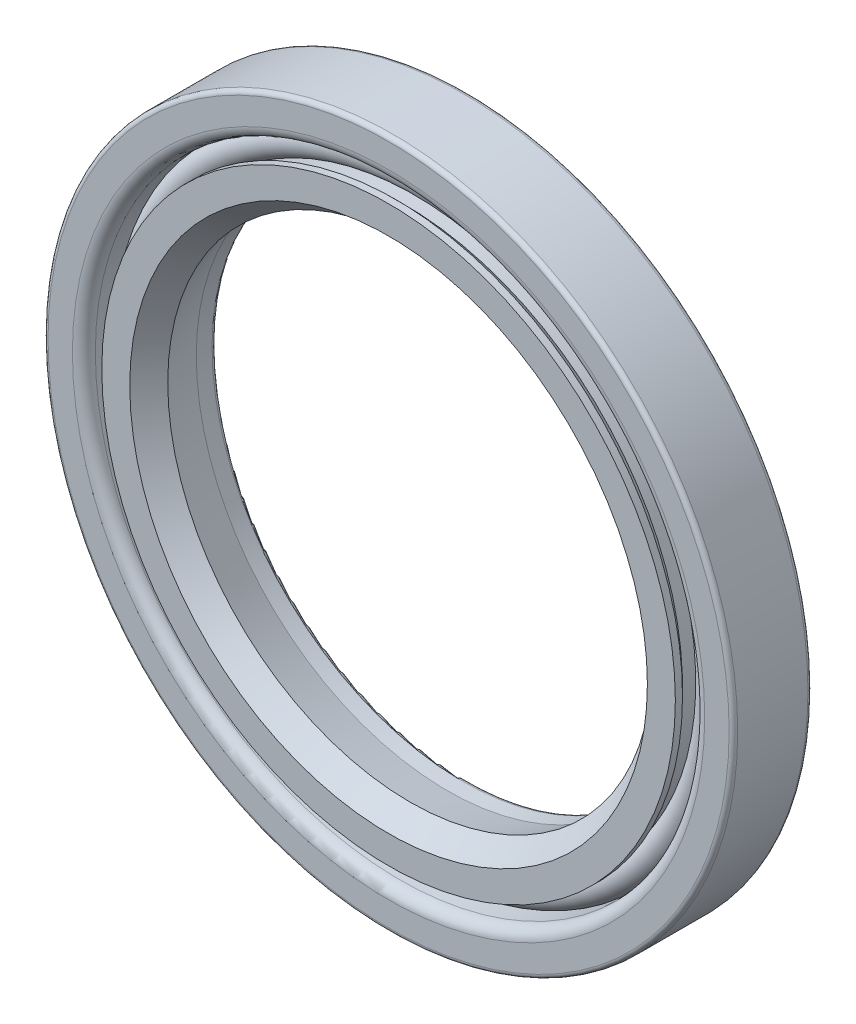
from build123d import *

# Parameters (mm, degrees)
SKETCH2_R = 1


with BuildPart() as part:
    # Sketch1 → Revolve1 (revolve)
    with BuildSketch(Plane(origin=(0, 0, 0), x_dir=(0, 0, -1), z_dir=(1, 0, 0)), mode=Mode.PRIVATE) as revolve1_sk:
        with BuildLine():
            Line((0, 17.81), (0, 23.75))
            ThreePointArc((0, 23.75), (-0.087867966, 23.962132034), (-0.3, 24.05))
            Line((-0.3, 24.05), (-5.2, 24.05))
            ThreePointArc((-5.2, 24.05), (-5.412132034, 23.962132034), (-5.5, 23.75))
            Line((-5.5, 23.75), (-5.5, 22.05))
            ThreePointArc((-5.5, 22.05), (-5.265685425, 21.484314575), (-4.7, 21.25))
            Line((-4.7, 21.25), (-3.3, 21.25))
            ThreePointArc((-3.3, 21.25), (-2.734314575, 21.015685425), (-2.5, 20.45))
            Line((-2.5, 20.45), (-2.5, 20.25))
            ThreePointArc((-2.5, 20.25), (-2.734314575, 19.684314575), (-3.3, 19.45))
            Line((-3.3, 19.45), (-4.45, 19.45))
            Line((-4.45, 19.45), (-5, 20))
            Line((-5, 20), (-5.5, 20))
            Line((-5.5, 20), (-5.5, 18.05))
            Line((-5.5, 18.05), (-4, 16.9))
            Line((-4, 16.9), (-1.4, 17.51))
            Line((-1.4, 17.51), (-0.3, 17.51))
            ThreePointArc((-0.3, 17.51), (-0.087867966, 17.597867966), (0, 17.81))
        make_face()
    revolve(revolve1_sk.sketch.rotate(Axis((0, 0, 0), (0, 0, 1)), 90), axis=Axis((0, 0, 0), (0, 0, 1)))


with BuildPart() as body_2:
    # Sketch2 → Revolve2 (revolve)
    with BuildSketch(Plane(origin=(0, 0, 0), x_dir=(0, 0, -1), z_dir=(1, 0, 0)), mode=Mode.PRIVATE) as revolve2_sk:
        with Locations((-3, 20.33882619)):
            Circle(SKETCH2_R)
    revolve(revolve2_sk.sketch.rotate(Axis((0, 0, 0), (0, 0, 1)), 90), axis=Axis((0, 0, 0), (0, 0, 1)))


with BuildPart() as body_3:
    # Sketch3 → Revolve4 (revolve)
    with BuildSketch(Plane(origin=(0, 0, 0), x_dir=(0, 0, -1), z_dir=(1, 0, 0)), mode=Mode.PRIVATE) as revolve4_sk:
        with BuildLine():
            Line((-4.5, 23.05), (-1.4, 23.05))
            ThreePointArc((-1.4, 23.05), (-0.834314575, 22.815685425), (-0.6, 22.25))
            Line((-0.6, 22.25), (-0.6, 19.45))
            Line((-0.6, 19.45), (-0.9, 19.45))
            Line((-0.9, 19.45), (-0.9, 22.25))
            ThreePointArc((-0.9, 22.25), (-1.046446609, 22.603553391), (-1.4, 22.75))
            Line((-1.4, 22.75), (-4.5, 22.75))
            Line((-4.5, 22.75), (-4.5, 23.05))
        make_face()
    revolve(revolve4_sk.sketch.rotate(Axis((0, 0, 0), (0, 0, 1)), 90), axis=Axis((0, 0, 0), (0, 0, 1)))


solid = Compound([part.part, body_2.part, body_3.part])
